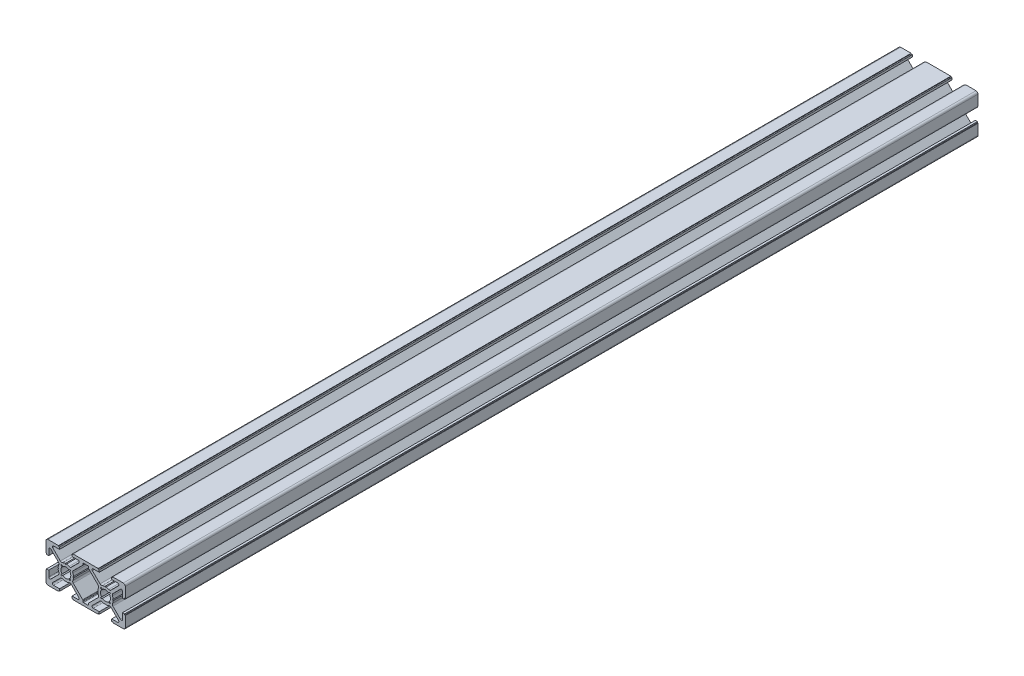
from build123d import *

# Parameters (mm, degrees)
BOSS_EXTRUDE1_DEPTH = 430


with BuildPart() as part:
    # Sketch1 → Boss-Extrude1 (new body)
    with BuildSketch(Plane.XY):
        with BuildLine():
            Line((-30, -3.7), (-30, -9))
            ThreePointArc((-30, -9), (-29.707106781, -9.707106781), (-29, -10))
            Line((-29, -10), (-23.7, -10))
            Line((-23.7, -10), (-23.7, -9.7))
            Line((-23.7, -9.7), (-23.15, -9.7))
            Line((-23.15, -9.7), (-23.15, -8.6))
            Line((-23.15, -8.6), (-26.161522369, -8.6))
            ThreePointArc((-26.161522369, -8.6), (-26.715850088, -8.229610059), (-26.585786438, -7.575735931))
            Line((-26.585786438, -7.575735931), (-22.754640615, -3.744590109))
            ThreePointArc((-22.754640615, -3.744590109), (-22.223761273, -3.467347415), (-21.629669786, -3.543187321))
            ThreePointArc((-21.629669786, -3.543187321), (-20.974942288, -3.776173663), (-20.289258242, -3.889258242))
            Line((-20.289258242, -3.889258242), (-20, -3.6))
            Line((-20, -3.6), (-19.710741758, -3.889258242))
            ThreePointArc((-19.710741758, -3.889258242), (-19.025057712, -3.776173663), (-18.370330214, -3.543187321))
            ThreePointArc((-18.370330214, -3.543187321), (-17.776238727, -3.467347415), (-17.245359385, -3.744590109))
            Line((-17.245359385, -3.744590109), (-13.414213562, -7.575735931))
            ThreePointArc((-13.414213562, -7.575735931), (-13.284149912, -8.229610059), (-13.838477631, -8.6))
            Line((-13.838477631, -8.6), (-16.85, -8.6))
            Line((-16.85, -8.6), (-16.85, -9.7))
            Line((-16.85, -9.7), (-16.3, -9.7))
            Line((-16.3, -9.7), (-16.3, -10))
            Line((-16.3, -10), (-3.7, -10))
            Line((-3.7, -10), (-3.7, -9.7))
            Line((-3.7, -9.7), (-3.15, -9.7))
            Line((-3.15, -9.7), (-3.15, -8.6))
            Line((-3.15, -8.6), (-6.161522369, -8.6))
            ThreePointArc((-6.161522369, -8.6), (-6.715850088, -8.229610059), (-6.585786438, -7.575735931))
            Line((-6.585786438, -7.575735931), (-2.754640615, -3.744590109))
            ThreePointArc((-2.754640615, -3.744590109), (-2.223761273, -3.467347415), (-1.629669786, -3.543187321))
            ThreePointArc((-1.629669786, -3.543187321), (-0.974942288, -3.776173663), (-0.289258242, -3.889258242))
            Line((-0.289258242, -3.889258242), (0, -3.6))
            Line((0, -3.6), (0.289258242, -3.889258242))
            ThreePointArc((0.289258242, -3.889258242), (0.974942288, -3.776173663), (1.629669786, -3.543187321))
            ThreePointArc((1.629669786, -3.543187321), (2.223761273, -3.467347415), (2.754640615, -3.744590109))
            Line((2.754640615, -3.744590109), (6.585786438, -7.575735931))
            ThreePointArc((6.585786438, -7.575735931), (6.715850088, -8.229610059), (6.161522369, -8.6))
            Line((6.161522369, -8.6), (3.15, -8.6))
            Line((3.15, -8.6), (3.15, -9.7))
            Line((3.15, -9.7), (3.7, -9.7))
            Line((3.7, -9.7), (3.7, -10))
            Line((3.7, -10), (9, -10))
            ThreePointArc((9, -10), (9.707106781, -9.707106781), (10, -9))
            Line((10, -9), (10, -3.7))
            Line((10, -3.7), (9.7, -3.7))
            Line((9.7, -3.7), (9.7, -3.15))
            Line((9.7, -3.15), (8.6, -3.15))
            Line((8.6, -3.15), (8.6, -6.161522369))
            ThreePointArc((8.6, -6.161522369), (8.229610059, -6.715850088), (7.575735931, -6.585786438))
            Line((7.575735931, -6.585786438), (3.744590109, -2.754640615))
            ThreePointArc((3.744590109, -2.754640615), (3.467347415, -2.223761273), (3.543187321, -1.629669786))
            ThreePointArc((3.543187321, -1.629669786), (3.776173663, -0.974942288), (3.889258242, -0.289258242))
            Line((3.889258242, -0.289258242), (3.6, 0))
            Line((3.6, 0), (3.889258242, 0.289258242))
            ThreePointArc((3.889258242, 0.289258242), (3.776173663, 0.974942288), (3.543187321, 1.629669786))
            ThreePointArc((3.543187321, 1.629669786), (3.467347415, 2.223761273), (3.744590109, 2.754640615))
            Line((3.744590109, 2.754640615), (7.575735931, 6.585786438))
            ThreePointArc((7.575735931, 6.585786438), (8.229610059, 6.715850088), (8.6, 6.161522369))
            Line((8.6, 6.161522369), (8.6, 3.15))
            Line((8.6, 3.15), (9.7, 3.15))
            Line((9.7, 3.15), (9.7, 3.7))
            Line((9.7, 3.7), (10, 3.7))
            Line((10, 3.7), (10, 9))
            ThreePointArc((10, 9), (9.707106781, 9.707106781), (9, 10))
            Line((9, 10), (3.7, 10))
            Line((3.7, 10), (3.7, 9.7))
            Line((3.7, 9.7), (3.15, 9.7))
            Line((3.15, 9.7), (3.15, 8.6))
            Line((3.15, 8.6), (6.161522369, 8.6))
            ThreePointArc((6.161522369, 8.6), (6.715850088, 8.229610059), (6.585786438, 7.575735931))
            Line((6.585786438, 7.575735931), (2.754640615, 3.744590109))
            ThreePointArc((2.754640615, 3.744590109), (2.223761273, 3.467347415), (1.629669786, 3.543187321))
            ThreePointArc((1.629669786, 3.543187321), (0.974942288, 3.776173663), (0.289258242, 3.889258242))
            Line((0.289258242, 3.889258242), (0, 3.6))
            Line((0, 3.6), (-0.289258242, 3.889258242))
            ThreePointArc((-0.289258242, 3.889258242), (-0.974942288, 3.776173663), (-1.629669786, 3.543187321))
            ThreePointArc((-1.629669786, 3.543187321), (-2.223761273, 3.467347415), (-2.754640615, 3.744590109))
            Line((-2.754640615, 3.744590109), (-6.585786438, 7.575735931))
            ThreePointArc((-6.585786438, 7.575735931), (-6.715850088, 8.229610059), (-6.161522369, 8.6))
            Line((-6.161522369, 8.6), (-3.15, 8.6))
            Line((-3.15, 8.6), (-3.15, 9.7))
            Line((-3.15, 9.7), (-3.7, 9.7))
            Line((-3.7, 9.7), (-3.7, 10))
            Line((-3.7, 10), (-16.3, 10))
            Line((-16.3, 10), (-16.3, 9.7))
            Line((-16.3, 9.7), (-16.85, 9.7))
            Line((-16.85, 9.7), (-16.85, 8.6))
            Line((-16.85, 8.6), (-13.838477631, 8.6))
            ThreePointArc((-13.838477631, 8.6), (-13.284149912, 8.229610059), (-13.414213562, 7.575735931))
            Line((-13.414213562, 7.575735931), (-17.245359385, 3.744590109))
            ThreePointArc((-17.245359385, 3.744590109), (-17.776238727, 3.467347415), (-18.370330214, 3.543187321))
            ThreePointArc((-18.370330214, 3.543187321), (-19.025057712, 3.776173663), (-19.710741758, 3.889258242))
            Line((-19.710741758, 3.889258242), (-20, 3.6))
            Line((-20, 3.6), (-20.289258242, 3.889258242))
            ThreePointArc((-20.289258242, 3.889258242), (-20.974942288, 3.776173663), (-21.629669786, 3.543187321))
            ThreePointArc((-21.629669786, 3.543187321), (-22.223761273, 3.467347415), (-22.754640615, 3.744590109))
            Line((-22.754640615, 3.744590109), (-26.585786438, 7.575735931))
            ThreePointArc((-26.585786438, 7.575735931), (-26.715850088, 8.229610059), (-26.161522369, 8.6))
            Line((-26.161522369, 8.6), (-23.15, 8.6))
            Line((-23.15, 8.6), (-23.15, 9.7))
            Line((-23.15, 9.7), (-23.7, 9.7))
            Line((-23.7, 9.7), (-23.7, 10))
            Line((-23.7, 10), (-29, 10))
            ThreePointArc((-29, 10), (-29.707106781, 9.707106781), (-30, 9))
            Line((-30, 9), (-30, 3.7))
            Line((-30, 3.7), (-29.7, 3.7))
            Line((-29.7, 3.7), (-29.7, 3.15))
            Line((-29.7, 3.15), (-28.6, 3.15))
            Line((-28.6, 3.15), (-28.6, 6.161522369))
            ThreePointArc((-28.6, 6.161522369), (-28.229610059, 6.715850088), (-27.575735931, 6.585786438))
            Line((-27.575735931, 6.585786438), (-23.744590109, 2.754640615))
            ThreePointArc((-23.744590109, 2.754640615), (-23.467347415, 2.223761273), (-23.543187321, 1.629669786))
            ThreePointArc((-23.543187321, 1.629669786), (-23.776173663, 0.974942288), (-23.889258242, 0.289258242))
            Line((-23.889258242, 0.289258242), (-23.6, 0))
            Line((-23.6, 0), (-23.889258242, -0.289258242))
            ThreePointArc((-23.889258242, -0.289258242), (-23.776173663, -0.974942288), (-23.543187321, -1.629669786))
            ThreePointArc((-23.543187321, -1.629669786), (-23.467347415, -2.223761273), (-23.744590109, -2.754640615))
            Line((-23.744590109, -2.754640615), (-27.575735931, -6.585786438))
            ThreePointArc((-27.575735931, -6.585786438), (-28.229610059, -6.715850088), (-28.6, -6.161522369))
            Line((-28.6, -6.161522369), (-28.6, -3.15))
            Line((-28.6, -3.15), (-29.7, -3.15))
            Line((-29.7, -3.15), (-29.7, -3.7))
            Line((-29.7, -3.7), (-30, -3.7))
        make_face()
        with BuildLine():
            Line((1.967124912, 1.542860843), (2.333452378, 1.909188309))
            ThreePointArc((2.333452378, 1.909188309), (2.333452378, 2.333452378), (1.909188309, 2.333452378))
            Line((1.909188309, 2.333452378), (1.542860843, 1.967124912))
            ThreePointArc((1.542860843, 1.967124912), (0, 2.5), (-1.542860843, 1.967124912))
            Line((-1.542860843, 1.967124912), (-1.909188309, 2.333452378))
            ThreePointArc((-1.909188309, 2.333452378), (-2.333452378, 2.333452378), (-2.333452378, 1.909188309))
            Line((-2.333452378, 1.909188309), (-1.967124912, 1.542860843))
            ThreePointArc((-1.967124912, 1.542860843), (-2.5, 0), (-1.967124912, -1.542860843))
            Line((-1.967124912, -1.542860843), (-2.333452378, -1.909188309))
            ThreePointArc((-2.333452378, -1.909188309), (-2.333452378, -2.333452378), (-1.909188309, -2.333452378))
            Line((-1.909188309, -2.333452378), (-1.542860843, -1.967124912))
            ThreePointArc((-1.542860843, -1.967124912), (0, -2.5), (1.542860843, -1.967124912))
            Line((1.542860843, -1.967124912), (1.909188309, -2.333452378))
            ThreePointArc((1.909188309, -2.333452378), (2.333452378, -2.333452378), (2.333452378, -1.909188309))
            Line((2.333452378, -1.909188309), (1.967124912, -1.542860843))
            ThreePointArc((1.967124912, -1.542860843), (2.5, 0), (1.967124912, 1.542860843))
        make_face(mode=Mode.SUBTRACT)
        with BuildLine():
            Line((-17.666547622, -1.909188309), (-18.032875088, -1.542860843))
            ThreePointArc((-18.032875088, -1.542860843), (-17.5, 0), (-18.032875088, 1.542860843))
            Line((-18.032875088, 1.542860843), (-17.666547622, 1.909188309))
            ThreePointArc((-17.666547622, 1.909188309), (-17.666547622, 2.333452378), (-18.090811691, 2.333452378))
            Line((-18.090811691, 2.333452378), (-18.457139157, 1.967124912))
            ThreePointArc((-18.457139157, 1.967124912), (-20, 2.5), (-21.542860843, 1.967124912))
            Line((-21.542860843, 1.967124912), (-21.909188309, 2.333452378))
            ThreePointArc((-21.909188309, 2.333452378), (-22.333452378, 2.333452378), (-22.333452378, 1.909188309))
            Line((-22.333452378, 1.909188309), (-21.967124912, 1.542860843))
            ThreePointArc((-21.967124912, 1.542860843), (-22.5, 0), (-21.967124912, -1.542860843))
            Line((-21.967124912, -1.542860843), (-22.333452378, -1.909188309))
            ThreePointArc((-22.333452378, -1.909188309), (-22.333452378, -2.333452378), (-21.909188309, -2.333452378))
            Line((-21.909188309, -2.333452378), (-21.542860843, -1.967124912))
            ThreePointArc((-21.542860843, -1.967124912), (-20, -2.5), (-18.457139157, -1.967124912))
            Line((-18.457139157, -1.967124912), (-18.090811691, -2.333452378))
            ThreePointArc((-18.090811691, -2.333452378), (-17.666547622, -2.333452378), (-17.666547622, -1.909188309))
        make_face(mode=Mode.SUBTRACT)
        with BuildLine():
            Line((-16.110741758, 0.289258242), (-16.4, 0))
            Line((-16.4, 0), (-16.110741758, -0.289258242))
            ThreePointArc((-16.110741758, -0.289258242), (-16.223826337, -0.974942288), (-16.456812679, -1.629669786))
            ThreePointArc((-16.456812679, -1.629669786), (-16.532652585, -2.223761273), (-16.255409891, -2.754640615))
            Line((-16.255409891, -2.754640615), (-11.487867966, -7.522182541))
            ThreePointArc((-11.487867966, -7.522182541), (-11.42283614, -7.619509545), (-11.4, -7.734314575))
            Line((-11.4, -7.734314575), (-11.4, -8.3))
            ThreePointArc((-11.4, -8.3), (-11.312132034, -8.512132034), (-11.1, -8.6))
            Line((-11.1, -8.6), (-8.9, -8.6))
            ThreePointArc((-8.9, -8.6), (-8.687867966, -8.512132034), (-8.6, -8.3))
            Line((-8.6, -8.3), (-8.6, -7.734314575))
            ThreePointArc((-8.6, -7.734314575), (-8.57716386, -7.619509545), (-8.512132034, -7.522182541))
            Line((-8.512132034, -7.522182541), (-3.744590109, -2.754640615))
            ThreePointArc((-3.744590109, -2.754640615), (-3.467347415, -2.223761273), (-3.543187321, -1.629669786))
            ThreePointArc((-3.543187321, -1.629669786), (-3.776173663, -0.974942288), (-3.889258242, -0.289258242))
            Line((-3.889258242, -0.289258242), (-3.6, 0))
            Line((-3.6, 0), (-3.889258242, 0.289258242))
            ThreePointArc((-3.889258242, 0.289258242), (-3.776173663, 0.974942288), (-3.543187321, 1.629669786))
            ThreePointArc((-3.543187321, 1.629669786), (-3.467347415, 2.223761273), (-3.744590109, 2.754640615))
            Line((-3.744590109, 2.754640615), (-8.512132034, 7.522182541))
            ThreePointArc((-8.512132034, 7.522182541), (-8.57716386, 7.619509545), (-8.6, 7.734314575))
            Line((-8.6, 7.734314575), (-8.6, 8.3))
            ThreePointArc((-8.6, 8.3), (-8.687867966, 8.512132034), (-8.9, 8.6))
            Line((-8.9, 8.6), (-11.1, 8.6))
            ThreePointArc((-11.1, 8.6), (-11.312132034, 8.512132034), (-11.4, 8.3))
            Line((-11.4, 8.3), (-11.4, 7.734314575))
            ThreePointArc((-11.4, 7.734314575), (-11.42283614, 7.619509545), (-11.487867966, 7.522182541))
            Line((-11.487867966, 7.522182541), (-16.255409891, 2.754640615))
            ThreePointArc((-16.255409891, 2.754640615), (-16.532652585, 2.223761273), (-16.456812679, 1.629669786))
            ThreePointArc((-16.456812679, 1.629669786), (-16.223826337, 0.974942288), (-16.110741758, 0.289258242))
        make_face(mode=Mode.SUBTRACT)
    extrude(amount=BOSS_EXTRUDE1_DEPTH)


solid = part.part
